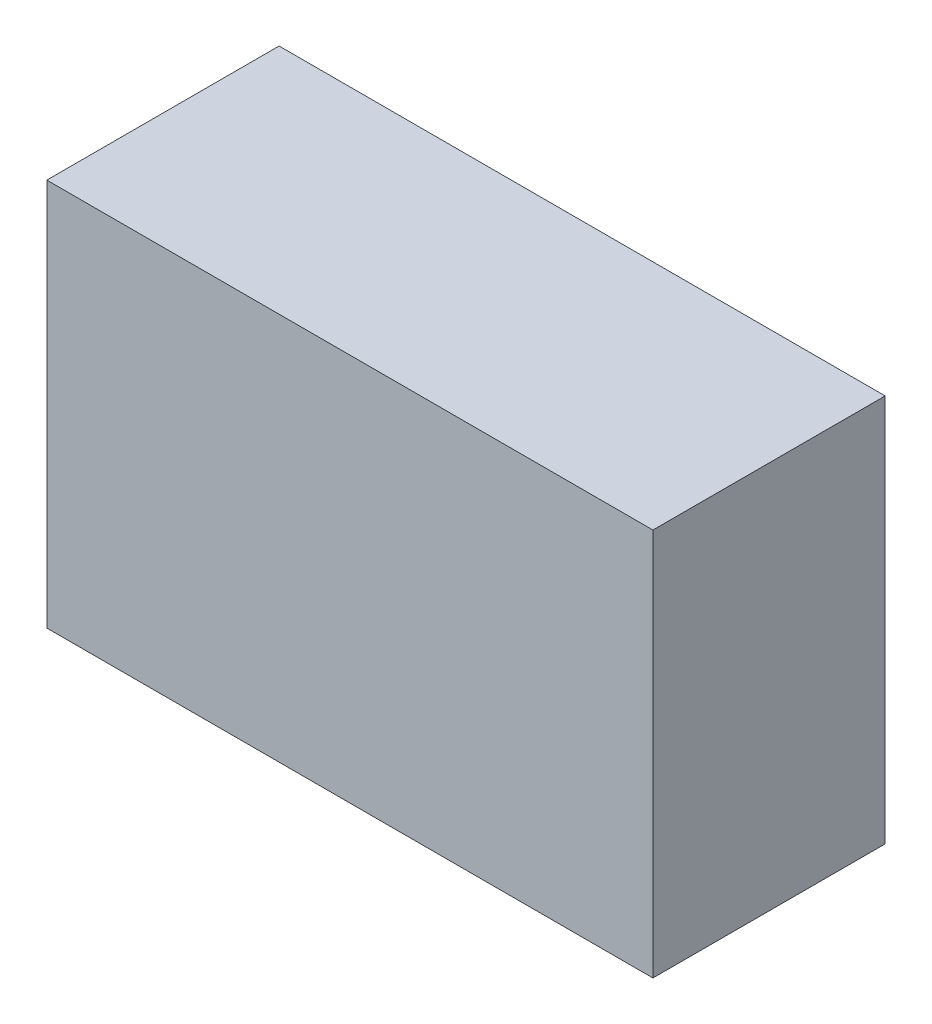
from build123d import *

# Parameters (mm, degrees)
SKETCH2_W           = 138.296391428
SKETCH2_H           = 88.525728834
BOSS_EXTRUDE1_DEPTH = 53


with BuildPart() as part:
    # Sketch2 → Boss-Extrude1 (new body)
    with BuildSketch(Plane.XY):
        Rectangle(SKETCH2_W, SKETCH2_H)
    extrude(amount=BOSS_EXTRUDE1_DEPTH)


solid = part.part
